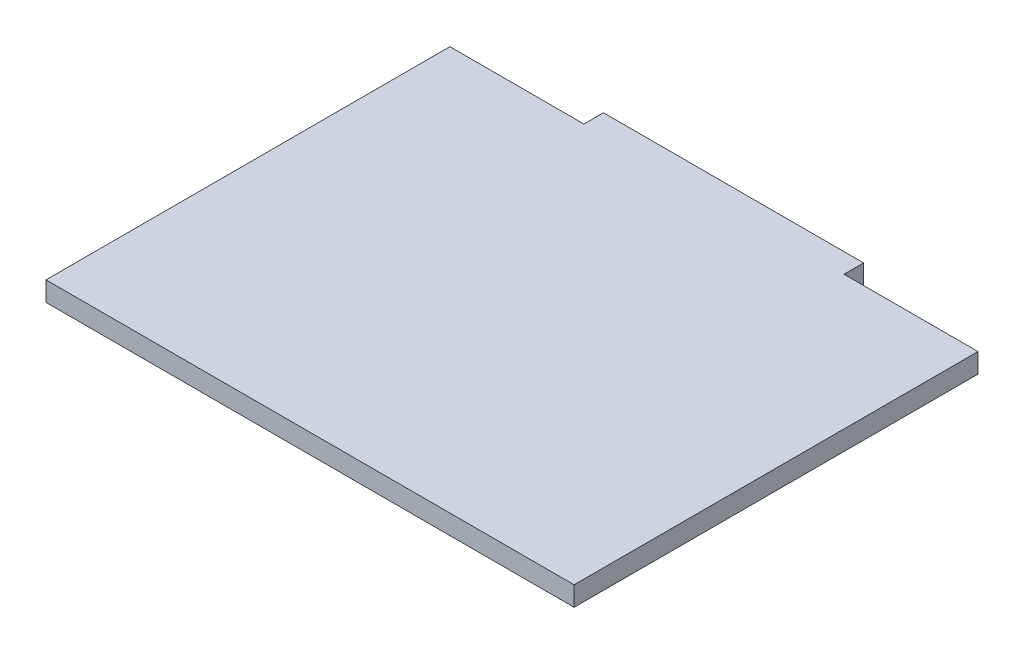
from build123d import *

# Parameters (mm, degrees)
BOSS_EXTRUDE1_DEPTH = 1.5


with BuildPart() as part:
    # Sketch1 → Boss-Extrude1 (new body)
    with BuildSketch(Plane(origin=(0, 0, 0), x_dir=(1, 0, 0), z_dir=(0, 1, 0))):
        Polygon((0, 0), (40.5, 0), (40.5, 30.975), (30.225, 30.975), (30.225, 32.475), (10.275, 32.475), (10.275, 30.975), (0, 30.975), align=None)
    extrude(amount=BOSS_EXTRUDE1_DEPTH)


solid = part.part
